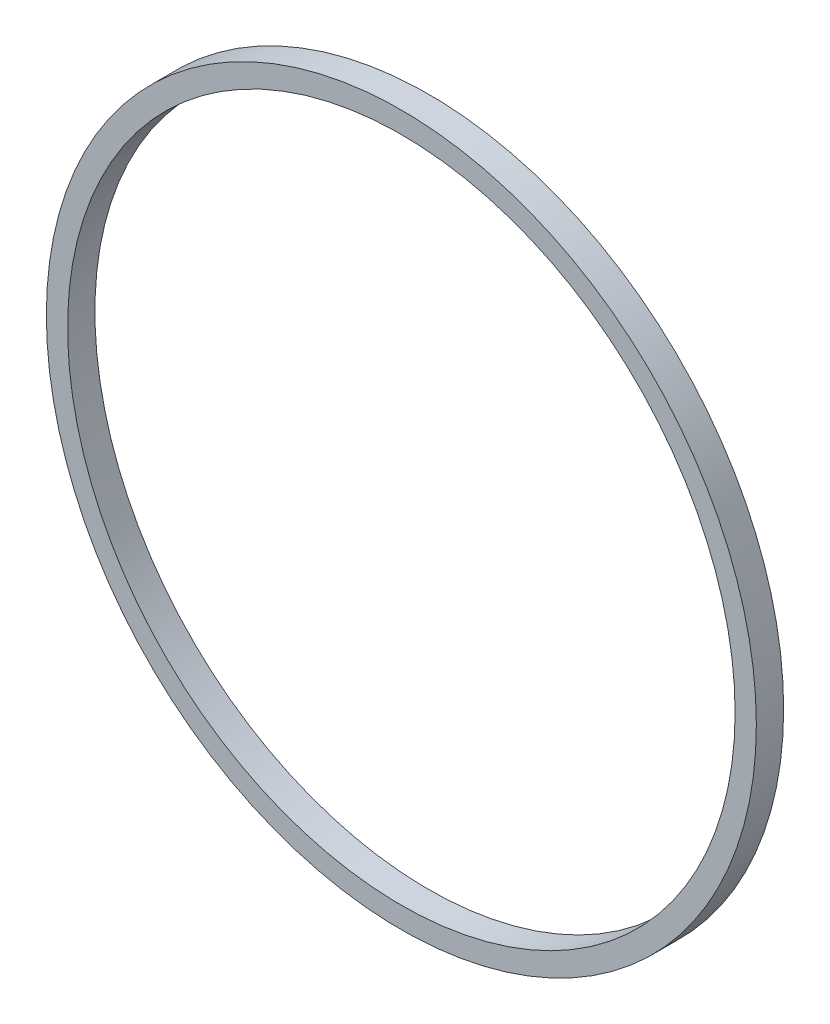
from build123d import *

# Parameters (mm, degrees)
SKETCH1_R           = 58.5
SKETCH1_R_2         = 55
BOSS_EXTRUDE1_DEPTH = 2.25


with BuildPart() as part:
    # Sketch1 → Boss-Extrude1 (new, symmetric)
    with BuildSketch(Plane.XY):
        with Locations((57.874950517, 92.254448376)):
            Circle(SKETCH1_R)
        with Locations((57.874950517, 92.254448376)):
            Circle(SKETCH1_R_2, mode=Mode.SUBTRACT)
    extrude(amount=BOSS_EXTRUDE1_DEPTH, both=True)


solid = part.part
